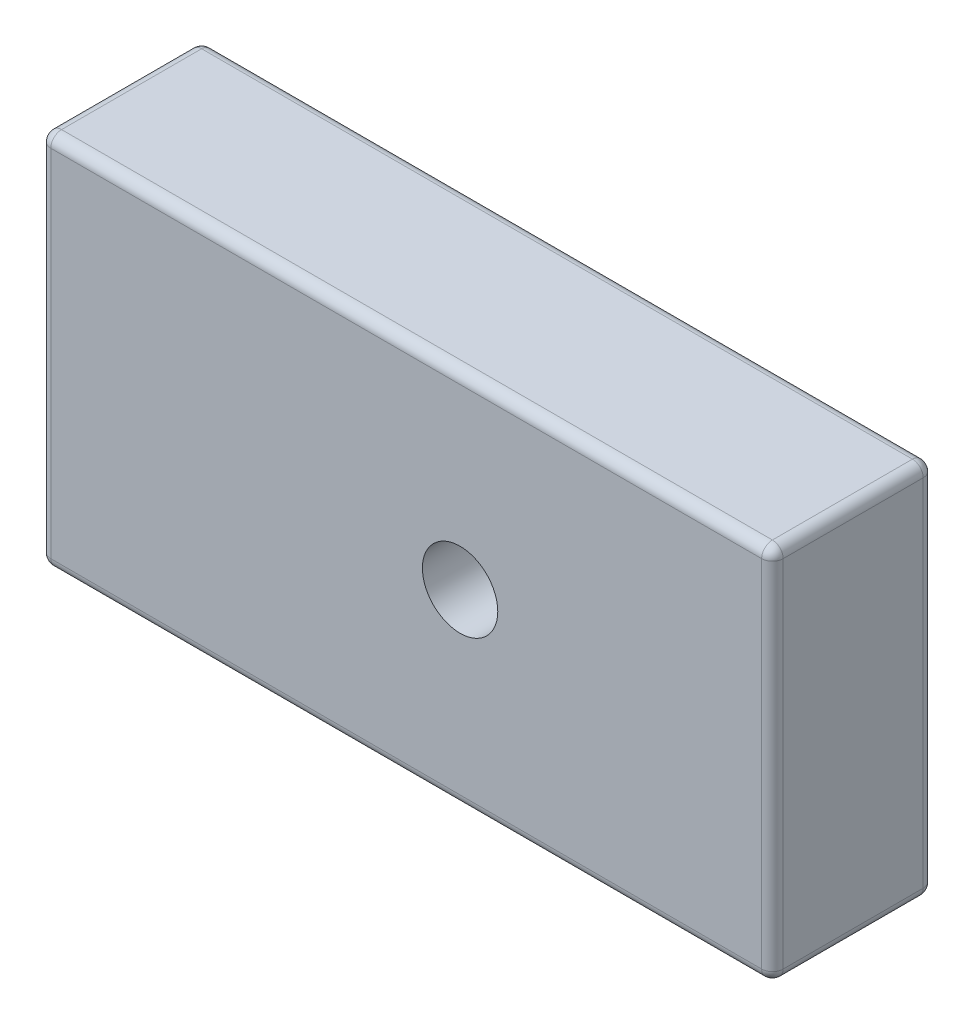
from build123d import *

# Parameters (mm, degrees)
SKETCH1_W           = 68
SKETCH1_H           = 35
BOSS_EXTRUDE1_DEPTH = 15
FILLET1_R           = 1
FILLET2_R           = 1
FILLET3_R           = 1
FILLET4_R           = 1
SKETCH2_R           = 3.5
CUT_EXTRUDE1_DEPTH  = 5


with BuildPart() as part:
    # Sketch1 → Boss-Extrude1 (new body)
    with BuildSketch(Plane.XY):
        Rectangle(SKETCH1_W, SKETCH1_H)
    extrude(amount=BOSS_EXTRUDE1_DEPTH)

    # Fillet1
    fillet1_edges = [part.edges().sort_by_distance(p)[0] for p in [
        (-34, 0, 15),
        (-34, 0, 0),
    ]]
    fillet(fillet1_edges, radius=FILLET1_R)

    # Fillet2
    fillet2_edges = [part.edges().sort_by_distance(p)[0] for p in [
        (34, 0, 15),
        (34, 0, 0),
    ]]
    fillet(fillet2_edges, radius=FILLET2_R)

    # Fillet3
    fillet3_edges = [part.edges().sort_by_distance(p)[0] for p in [
        (-34, -17.5, 7.5),
        (0, -17.5, 0),
        (0, -17.5, 15),
        (-33.707106781, -17.5, 14.707106781),
        (-33.707106781, -17.5, 0.292893219),
        (34, -17.5, 7.5),
        (33.707106781, -17.5, 14.707106781),
        (33.707106781, -17.5, 0.292893219),
    ]]
    fillet(fillet3_edges, radius=FILLET3_R)

    # Fillet4
    fillet4_edges = [part.edges().sort_by_distance(p)[0] for p in [
        (-34, 17.5, 7.5),
        (-33.707106781, 17.5, 14.707106781),
        (-33.707106781, 17.5, 0.292893219),
        (34, 17.5, 7.5),
        (0, 17.5, 0),
        (0, 17.5, 15),
        (33.707106781, 17.5, 14.707106781),
        (33.707106781, 17.5, 0.292893219),
    ]]
    fillet(fillet4_edges, radius=FILLET4_R)

    # Sketch2 → Cut-Extrude1 (cut)
    with BuildSketch(Plane.XY.offset(15)):
        with Locations((5, 0)):
            Circle(SKETCH2_R)
    extrude(amount=-CUT_EXTRUDE1_DEPTH, mode=Mode.SUBTRACT)


solid = part.part
